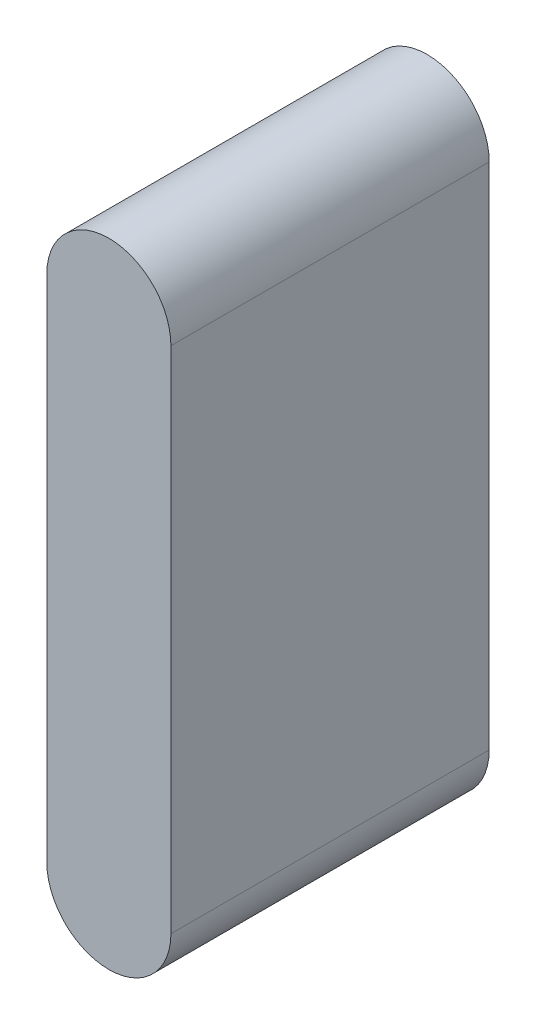
from build123d import *

# Parameters (mm, degrees)
EXTRUDE_1_DEPTH = 10


with BuildPart() as part:
    # 草图1 → 凸台-拉伸1 (new body)
    with BuildSketch(Plane.XY):
        with BuildLine():
            Line((1.95, 9.541071429), (1.95, -6.458928571))
            ThreePointArc((1.95, -6.458928571), (0, -8.408928571), (-1.95, -6.458928571))
            Line((-1.95, -6.458928571), (-1.95, 9.541071429))
            ThreePointArc((-1.95, 9.541071429), (0, 11.491071429), (1.95, 9.541071429))
        make_face()
    extrude(amount=EXTRUDE_1_DEPTH)


solid = part.part
